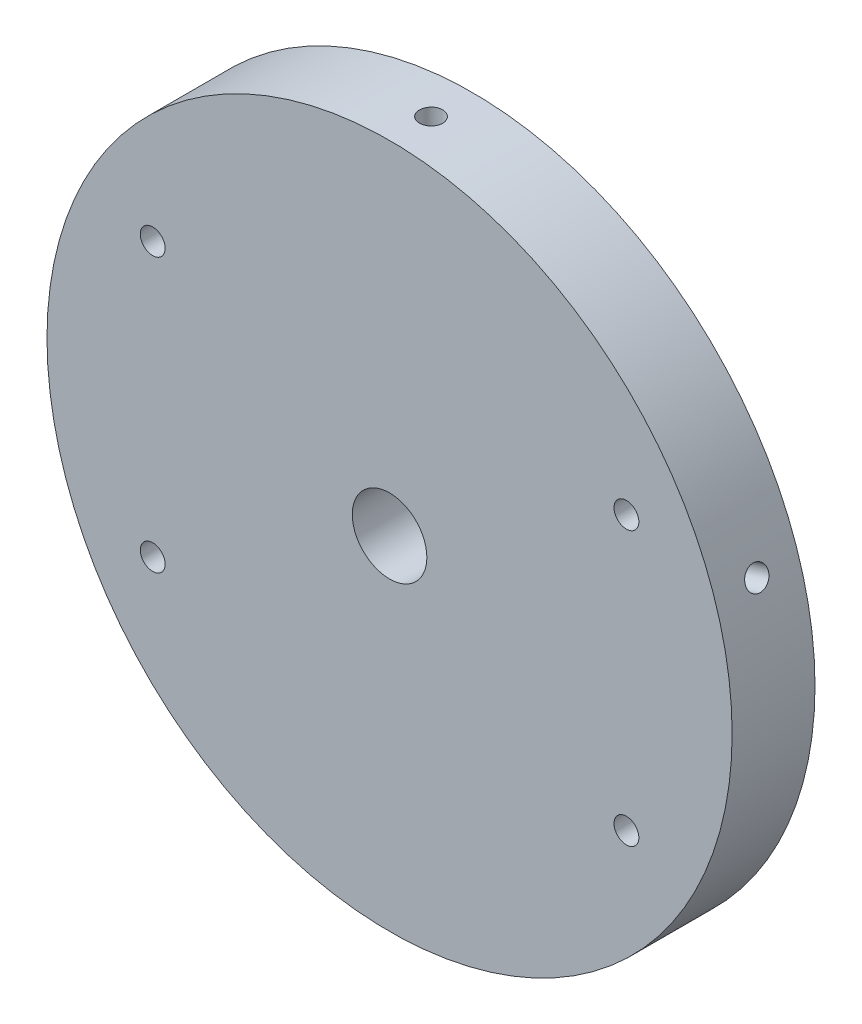
from build123d import *

# Parameters (mm, degrees)
SKETCH1_R                       = 62
BOSS_EXTRUDE1_DEPTH             = 15
M4_CLEARANCE_HOLE1_D            = 4.5
M12_CLEARANCE_HOLE1_D           = 13.5
M5_TAPPED_HOLE1_D               = 4.2
M5_TAPPED_HOLE1_DEPTH           = 12.4
M5_TAPPED_HOLE1_TIP             = 1.2618073
M5_TAPPED_HOLE1_ON_FACE_2_D     = 4.2
M5_TAPPED_HOLE1_ON_FACE_2_DEPTH = 12.4
M5_TAPPED_HOLE1_ON_FACE_2_TIP   = 1.2618073
M5_TAPPED_HOLE1_ON_FACE_3_D     = 4.2
M5_TAPPED_HOLE1_ON_FACE_3_DEPTH = 12.4
M5_TAPPED_HOLE1_ON_FACE_3_TIP   = 1.2618073
M5_TAPPED_HOLE1_ON_FACE_4_D     = 4.2
M5_TAPPED_HOLE1_ON_FACE_4_DEPTH = 12.4
M5_TAPPED_HOLE1_ON_FACE_4_TIP   = 1.2618073
M5_TAPPED_HOLE1_ON_FACE_5_D     = 4.2
M5_TAPPED_HOLE1_ON_FACE_5_DEPTH = 12.4
M5_TAPPED_HOLE1_ON_FACE_5_TIP   = 1.2618073


with BuildPart() as part:
    # Sketch1 → Boss-Extrude1 (new body)
    with BuildSketch(Plane.XY):
        Circle(SKETCH1_R)
    extrude(amount=BOSS_EXTRUDE1_DEPTH)

    # M4 Clearance Hole1 (through all)
    with Locations(Plane(origin=(0, 0, 0), x_dir=(-1, 0, 0), z_dir=(0, 0, -1))):
        with Locations((-42.868257487, 24.75), (-42.868257487, -24.75), (42.868257487, -24.75), (42.868257487, 24.75)):
            Hole(M4_CLEARANCE_HOLE1_D / 2)

    # M12 Clearance Hole1 (through all)
    with Locations(Plane(origin=(0, 0, 0), x_dir=(-1, 0, 0), z_dir=(0, 0, -1))):
        with Locations((0, 0)):
            Hole(M12_CLEARANCE_HOLE1_D / 2)

    # M5 Tapped Hole1
    with Locations(Plane(origin=(0, 62, 7.5), x_dir=(1, 0, 0), z_dir=(0, 1, 0))):
        with Locations((0, 0)):
            Hole(M5_TAPPED_HOLE1_D / 2, depth=M5_TAPPED_HOLE1_DEPTH)
            with Locations((0, 0, -(M5_TAPPED_HOLE1_DEPTH + M5_TAPPED_HOLE1_TIP / 2))):  # 118° drill point
                Cone(0, M5_TAPPED_HOLE1_D / 2, M5_TAPPED_HOLE1_TIP, mode=Mode.SUBTRACT)

    # M5 Tapped Hole1 on face 2
    with Locations(Plane(origin=(58.96550401, 19.159053651, 7.5), x_dir=(-0.309016857306, 0.951056560832, 0), z_dir=(0.951056560832, 0.309016857306, 0))):
        with Locations((0, 0)):
            Hole(M5_TAPPED_HOLE1_ON_FACE_2_D / 2, depth=M5_TAPPED_HOLE1_ON_FACE_2_DEPTH)
            with Locations((0, 0, -(M5_TAPPED_HOLE1_ON_FACE_2_DEPTH + M5_TAPPED_HOLE1_ON_FACE_2_TIP / 2))):  # 118° drill point
                Cone(0, M5_TAPPED_HOLE1_ON_FACE_2_D / 2, M5_TAPPED_HOLE1_ON_FACE_2_TIP, mode=Mode.SUBTRACT)

    # M5 Tapped Hole1 on face 3
    with Locations(Plane(origin=(36.442685642, -50.159053651, 7.5), x_dir=(-0.809017116291, -0.58778508449, 0), z_dir=(0.58778508449, -0.809017116291, 0))):
        with Locations((0, 0)):
            Hole(M5_TAPPED_HOLE1_ON_FACE_3_D / 2, depth=M5_TAPPED_HOLE1_ON_FACE_3_DEPTH)
            with Locations((0, 0, -(M5_TAPPED_HOLE1_ON_FACE_3_DEPTH + M5_TAPPED_HOLE1_ON_FACE_3_TIP / 2))):  # 118° drill point
                Cone(0, M5_TAPPED_HOLE1_ON_FACE_3_D / 2, M5_TAPPED_HOLE1_ON_FACE_3_TIP, mode=Mode.SUBTRACT)

    # M5 Tapped Hole1 on face 4
    with Locations(Plane(origin=(-36.442685642, -50.159053651, 7.5), x_dir=(-0.809017116291, 0.58778508449, 0), z_dir=(-0.58778508449, -0.809017116291, 0))):
        with Locations((0, 0)):
            Hole(M5_TAPPED_HOLE1_ON_FACE_4_D / 2, depth=M5_TAPPED_HOLE1_ON_FACE_4_DEPTH)
            with Locations((0, 0, -(M5_TAPPED_HOLE1_ON_FACE_4_DEPTH + M5_TAPPED_HOLE1_ON_FACE_4_TIP / 2))):  # 118° drill point
                Cone(0, M5_TAPPED_HOLE1_ON_FACE_4_D / 2, M5_TAPPED_HOLE1_ON_FACE_4_TIP, mode=Mode.SUBTRACT)

    # M5 Tapped Hole1 on face 5
    with Locations(Plane(origin=(-58.96550401, 19.159053651, 7.5), x_dir=(-0.309016857306, -0.951056560832, 0), z_dir=(-0.951056560832, 0.309016857306, 0))):
        with Locations((0, 0)):
            Hole(M5_TAPPED_HOLE1_ON_FACE_5_D / 2, depth=M5_TAPPED_HOLE1_ON_FACE_5_DEPTH)
            with Locations((0, 0, -(M5_TAPPED_HOLE1_ON_FACE_5_DEPTH + M5_TAPPED_HOLE1_ON_FACE_5_TIP / 2))):  # 118° drill point
                Cone(0, M5_TAPPED_HOLE1_ON_FACE_5_D / 2, M5_TAPPED_HOLE1_ON_FACE_5_TIP, mode=Mode.SUBTRACT)


solid = part.part
